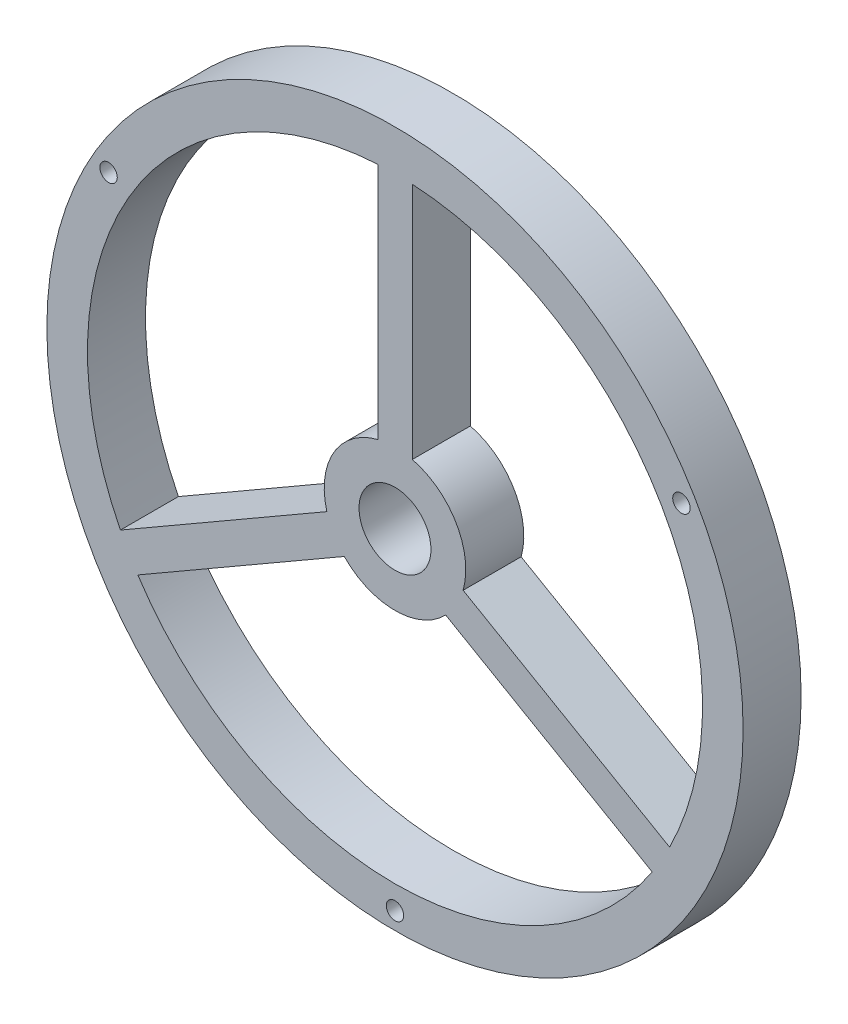
from build123d import *

# Parameters (mm, degrees)
SKETCH_1_R          = 3.1
EXTRUDE_2_DEPTH     = 5
SKETCH_2_R          = 0.75
CUT_EXTRUDE_1_DEPTH = 5


with BuildPart() as part:
    # 草图1 → 凸台-拉伸2 (new body)
    # profile 1 of 13: a face of its own
    with BuildSketch(Plane.XY):
        with BuildLine():
            ThreePointArc((46.84834221, 57.889935626), (22.328704618, 42.947388438), (21.598208517, 14.242707294))
            Line((21.598208517, 14.242707294), (24.63359588, 15.995189006))
            ThreePointArc((24.63359588, 15.995189006), (25.35979925, 41.197395358), (46.84834221, 54.385310198))
            Line((46.84834221, 54.385310198), (46.84834221, 57.889935626))
        make_face()
    # profile 2 of 13: a face of its own
    with BuildSketch(Plane.XY):
        with BuildLine():
            Line((71.95935283, 15.995189006), (74.994740193, 14.242707294))
            ThreePointArc((74.994740193, 14.242707294), (77.459361516, 20.887435435), (78.296474355, 27.924907455))
            ThreePointArc((78.296474355, 27.924907455), (70.030591529, 48.60407936), (49.787930978, 57.887810471))
            Line((49.787930978, 57.887810471), (49.787930978, 54.382903546))
            ThreePointArc((49.787930978, 54.382903546), (67.554895896, 46.128291749), (74.796474355, 27.924907455))
            ThreePointArc((74.796474355, 27.924907455), (74.077439034, 21.793687331), (71.95935283, 15.995189006))
        make_face()
    # profile 3 of 13: a face of its own
    with BuildSketch(Plane.XY):
        with BuildLine():
            ThreePointArc((23.098208517, 11.644631083), (48.296474355, -2.075092545), (73.494740193, 11.644631083))
            Line((73.494740193, 11.644631083), (70.45935283, 13.397112794))
            ThreePointArc((70.45935283, 13.397112794), (48.296474355, 1.424907455), (26.13359588, 13.397112794))
            Line((26.13359588, 13.397112794), (23.098208517, 11.644631083))
        make_face()
    # profile 4 of 13: a face of its own
    with BuildSketch(Plane.XY):
        with BuildLine():
            ThreePointArc((21.598208517, 14.242707294), (22.315712241, 12.924907455), (23.098208517, 11.644631083))
            Line((23.098208517, 11.644631083), (26.13359588, 13.397112794))
            ThreePointArc((26.13359588, 13.397112794), (25.346801155, 14.674907455), (24.63359588, 15.995189006))
            Line((24.63359588, 15.995189006), (21.598208517, 14.242707294))
        make_face()
    # profile 5 of 13: a face of its own
    with BuildSketch(Plane.XY):
        with BuildLine():
            ThreePointArc((24.63359588, 15.995189006), (25.346801155, 14.674907455), (26.13359588, 13.397112794))
            Line((26.13359588, 13.397112794), (43.925927509, 23.66952025))
            ThreePointArc((43.925927509, 23.66952025), (43.013719392, 24.874907455), (42.425927509, 26.267596461))
            Line((42.425927509, 26.267596461), (24.63359588, 15.995189006))
        make_face()
    # profile 6 of 13: a face of its own
    with BuildSketch(Plane.XY):
        with BuildLine():
            Line((52.565394479, 27.19229608), (54.167021201, 26.267596461))
            ThreePointArc((54.167021201, 26.267596461), (54.338838783, 27.088347762), (54.396474355, 27.924907455))
            ThreePointArc((54.396474355, 27.924907455), (53.108328748, 31.67404833), (49.787930978, 33.839766468))
            Line((49.787930978, 33.839766468), (49.787930978, 32.638782116))
            Line((49.787930978, 32.638782116), (46.84834221, 32.638782116))
            Line((46.84834221, 32.638782116), (46.84834221, 33.850522469))
            ThreePointArc((46.84834221, 33.850522469), (43.027133101, 30.998023585), (42.425927509, 26.267596461))
            Line((42.425927509, 26.267596461), (43.927397053, 27.134470306))
            Line((43.927397053, 27.134470306), (45.427397053, 24.536394095))
            Line((45.427397053, 24.536394095), (43.925927509, 23.66952025))
            ThreePointArc((43.925927509, 23.66952025), (48.296474355, 21.824907455), (52.667021201, 23.66952025))
            Line((52.667021201, 23.66952025), (51.065394479, 24.594219869))
            Line((51.065394479, 24.594219869), (52.565394479, 27.19229608))
        make_face()
        with Locations((48.296474355, 27.924907455)):
            Circle(SKETCH_1_R, mode=Mode.SUBTRACT)
    # profile 7 of 13: a face of its own
    with BuildSketch(Plane.XY):
        with BuildLine():
            ThreePointArc((42.425927509, 26.267596461), (43.013719392, 24.874907455), (43.925927509, 23.66952025))
            Line((43.925927509, 23.66952025), (45.427397053, 24.536394095))
            Line((45.427397053, 24.536394095), (43.927397053, 27.134470306))
            Line((43.927397053, 27.134470306), (42.425927509, 26.267596461))
        make_face()
    # profile 8 of 13: a face of its own
    with BuildSketch(Plane.XY):
        with BuildLine():
            ThreePointArc((52.667021201, 23.66952025), (53.579229318, 24.874907455), (54.167021201, 26.267596461))
            Line((54.167021201, 26.267596461), (52.565394479, 27.19229608))
            Line((52.565394479, 27.19229608), (51.065394479, 24.594219869))
            Line((51.065394479, 24.594219869), (52.667021201, 23.66952025))
        make_face()
    # profile 9 of 13: a face of its own
    with BuildSketch(Plane.XY):
        with BuildLine():
            Line((49.787930978, 32.638782116), (49.787930978, 33.839766468))
            ThreePointArc((49.787930978, 33.839766468), (48.3187942, 34.024866621), (46.84834221, 33.850522469))
            Line((46.84834221, 33.850522469), (46.84834221, 32.638782116))
            Line((46.84834221, 32.638782116), (49.787930978, 32.638782116))
        make_face()
    # profile 10 of 13: a face of its own
    with BuildSketch(Plane.XY):
        with BuildLine():
            Line((49.787930978, 33.839766468), (49.787930978, 54.382903546))
            ThreePointArc((49.787930978, 54.382903546), (48.31816999, 54.424898574), (46.84834221, 54.385310198))
            Line((46.84834221, 54.385310198), (46.84834221, 33.850522469))
            ThreePointArc((46.84834221, 33.850522469), (48.3187942, 34.024866621), (49.787930978, 33.839766468))
        make_face()
    # profile 11 of 13: a face of its own
    with BuildSketch(Plane.XY):
        with BuildLine():
            ThreePointArc((70.45935283, 13.397112794), (71.246147555, 14.674907455), (71.95935283, 15.995189006))
            Line((71.95935283, 15.995189006), (54.167021201, 26.267596461))
            ThreePointArc((54.167021201, 26.267596461), (53.579229318, 24.874907455), (52.667021201, 23.66952025))
            Line((52.667021201, 23.66952025), (70.45935283, 13.397112794))
        make_face()
    # profile 12 of 13: a face of its own
    with BuildSketch(Plane.XY):
        with BuildLine():
            ThreePointArc((73.494740193, 11.644631083), (74.277236468, 12.924907455), (74.994740193, 14.242707294))
            Line((74.994740193, 14.242707294), (71.95935283, 15.995189006))
            ThreePointArc((71.95935283, 15.995189006), (71.246147555, 14.674907455), (70.45935283, 13.397112794))
            Line((70.45935283, 13.397112794), (73.494740193, 11.644631083))
        make_face()
    # profile 13 of 13: a face of its own
    with BuildSketch(Plane.XY):
        with BuildLine():
            Line((49.787930978, 54.382903546), (49.787930978, 57.887810471))
            ThreePointArc((49.787930978, 57.887810471), (48.318162639, 57.924899616), (46.84834221, 57.889935626))
            Line((46.84834221, 57.889935626), (46.84834221, 54.385310198))
            ThreePointArc((46.84834221, 54.385310198), (48.31816999, 54.424898574), (49.787930978, 54.382903546))
        make_face()
    extrude(amount=EXTRUDE_2_DEPTH)

    # 草图2 → 切除-拉伸1 (cut)
    with BuildSketch(Plane.XY.offset(5)):
        with Locations((23.614750347, 42.174907455)):
            Circle(SKETCH_2_R)
        with Locations((72.978198363, 42.174907455)):
            Circle(SKETCH_2_R)
        with Locations((48.296474355, -0.575092545)):
            Circle(SKETCH_2_R)
    extrude(amount=-CUT_EXTRUDE_1_DEPTH, mode=Mode.SUBTRACT)


solid = part.part
